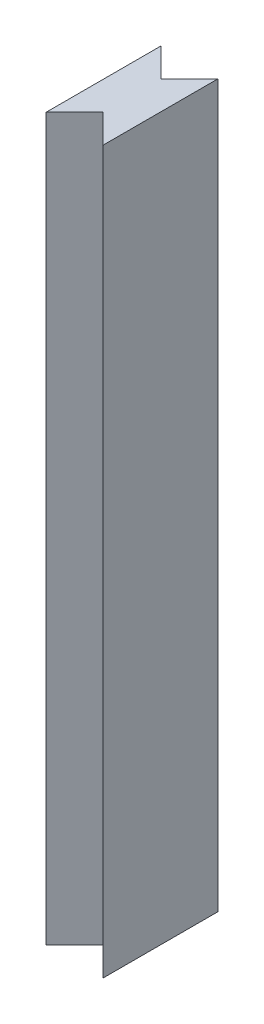
from build123d import *

# Parameters (mm, degrees)
SALIENTE_EXTRUIR1_DEPTH = 50


with BuildPart() as part:
    # Croquis1 → Saliente-Extruir1 (new body)
    with BuildSketch(Plane(origin=(0, 0, 0), x_dir=(1, 0, 0), z_dir=(0, 1, 0))):
        Polygon((1.975, 3.975), (0, 2), (-1.975, 3.975), (-1.975, -3.975), (0, -2), (1.975, -3.975), align=None)
    extrude(amount=SALIENTE_EXTRUIR1_DEPTH)


solid = part.part
